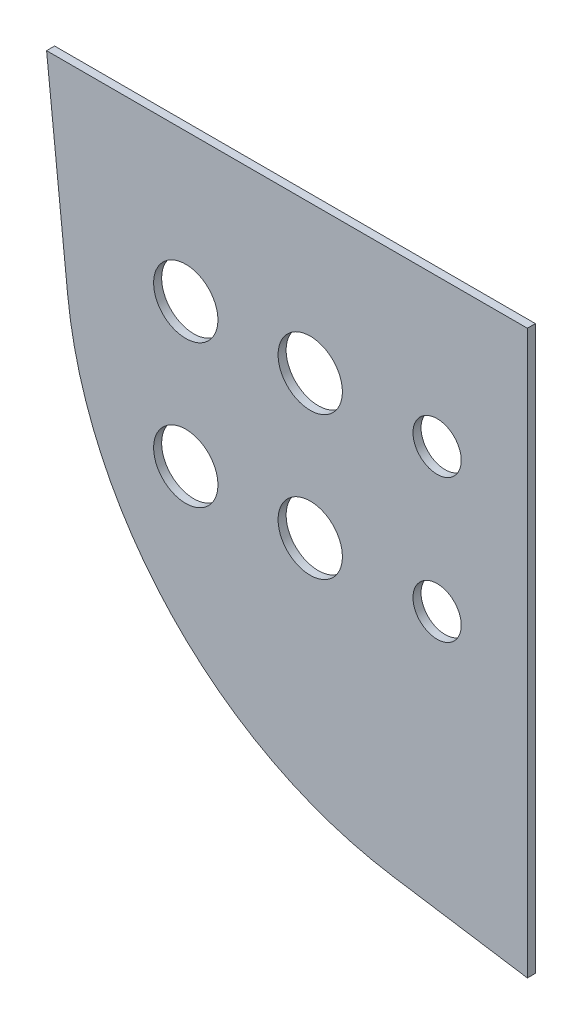
from build123d import *

# Parameters (mm, degrees)
BOSS_EXTRUDE1_DEPTH = 1.5875
SKETCH2_R           = 6.35
SKETCH2_R_2         = 4.7625
CUT_EXTRUDE1_DEPTH  = 200.339494535


with BuildPart() as part:
    # Sketch1 → Boss-Extrude1 (new body)
    with BuildSketch(Plane.XY):
        with BuildLine():
            Line((-29.004064566, -156.10056159), (-29.004064566, -44.966517074))
            Line((-29.004064566, -44.966517074), (-123.96099627, -44.966517074))
            Line((-123.96099627, -44.966517074), (-119.793452617, -84.639660454))
            ThreePointArc((-119.793452617, -84.639660454), (-99.185042421, -129.235543476), (-55.642806391, -151.98577501))
            Line((-55.642806391, -151.98577501), (-29.004064566, -156.10056159))
        make_face()
    extrude(amount=BOSS_EXTRUDE1_DEPTH)

    # Sketch2 → Cut-Extrude1 (cut, through all)
    with BuildSketch(Plane(origin=(0, 0, 0), x_dir=(-1, 0, 0), z_dir=(0, 0, -1))):
        with Locations((71.892516398, -102.315332665)):
            Circle(SKETCH2_R)
        with Locations((96.475228053, -102.315332665)):
            Circle(SKETCH2_R)
        with Locations((96.475228053, -74.107206632)):
            Circle(SKETCH2_R)
        with Locations((71.892516398, -74.107206632)):
            Circle(SKETCH2_R)
        with Locations((46.831572971, -102.315332665)):
            Circle(SKETCH2_R_2)
        with Locations((46.831572971, -74.107206632)):
            Circle(SKETCH2_R_2)
    extrude(amount=-CUT_EXTRUDE1_DEPTH, mode=Mode.SUBTRACT)


solid = part.part
